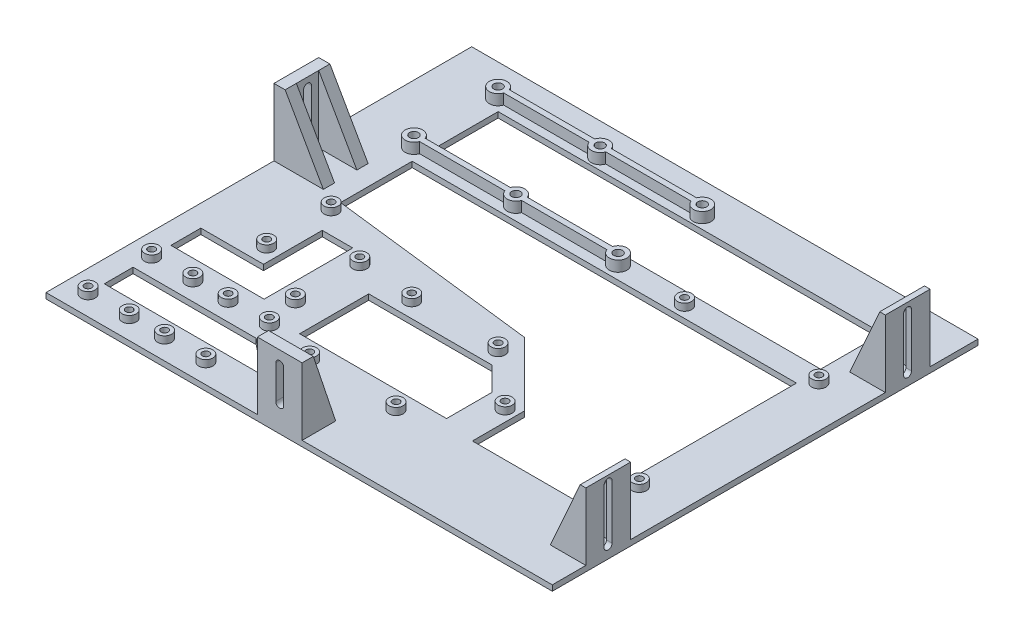
from build123d import *

# Parameters (mm, degrees)
SKETCH1_W            = 287.274
SKETCH1_H            = 241.554
BOSS_EXTRUDE1_DEPTH  = 3.175
SKETCH2_W            = 3.175
SKETCH2_H            = 25.4
BOSS_EXTRUDE3_DEPTH  = 38.1
CUT_EXTRUDE1_DEPTH   = 25.4
SKETCH4_R            = 4
SKETCH4_R_2          = 2
BOSS_EXTRUDE4_DEPTH  = 4
SKETCH5_R            = 5.000000033
SKETCH5_R_2          = 2.5
BOSS_EXTRUDE5_DEPTH  = 6
SKETCH6_R            = 4
SKETCH6_R_2          = 2
BOSS_EXTRUDE6_DEPTH  = 4
SKETCH7_R            = 4.000000001
SKETCH7_R_2          = 2
SKETCH7_R_3          = 4
BOSS_EXTRUDE7_DEPTH  = 4
SKETCH8_R            = 4
SKETCH8_R_2          = 2
BOSS_EXTRUDE8_DEPTH  = 4
SKETCH9_W            = 3.175
SKETCH9_H            = 25.4
BOSS_EXTRUDE9_DEPTH  = 38.1
CUT_EXTRUDE3_DEPTH   = 38.1
BOSS_EXTRUDE11_DEPTH = 6.35
BOSS_EXTRUDE12_DEPTH = 6.35
BOSS_EXTRUDE13_DEPTH = 6.35
SKETCH34_W           = 218.059
SKETCH34_H           = 35.052
CUT_EXTRUDE10_DEPTH  = 192.494860239
BOSS_EXTRUDE14_DEPTH = 6.35
SKETCH40_W           = 108.823999991
SKETCH40_H           = 3.175
BOSS_EXTRUDE15_DEPTH = 6
CUT_EXTRUDE13_START  = -6
SKETCH41_R           = 2.5
CUT_EXTRUDE13_DEPTH  = 6
SKETCH43_W           = 6.35
SKETCH43_H           = 25.4
BOSS_EXTRUDE16_DEPTH = 38.1
BOSS_EXTRUDE17_DEPTH = 25.4
SKETCH46_W           = 21.669999967
SKETCH46_H           = 12.7
CUT_EXTRUDE14_DEPTH  = 38.1
CUT_EXTRUDE15_DEPTH  = 38.1
SKETCH48_W           = 25.4
SKETCH48_H           = 6.35
BOSS_EXTRUDE18_DEPTH = 38.1
BOSS_EXTRUDE19_DEPTH = 25.4
SKETCH50_W           = 12.7
SKETCH50_H           = 12.7
CUT_EXTRUDE16_DEPTH  = 38.1
CUT_EXTRUDE17_DEPTH  = 38.1
CUT_EXTRUDE18_DEPTH  = 192.494860239


with BuildPart() as part:
    # Sketch1 → Boss-Extrude1 (new body)
    with BuildSketch(Plane(origin=(0, 0, 0), x_dir=(1, 0, 0), z_dir=(0, 1, 0))):
        Rectangle(SKETCH1_W, SKETCH1_H)
    extrude(amount=BOSS_EXTRUDE1_DEPTH)

    # Sketch2 → Boss-Extrude3 (add)
    with BuildSketch(Plane(origin=(0, 3.175, 0), x_dir=(1, 0, 0), z_dir=(0, 1, 0))):
        with Locations((142.0495, 80.899)):
            Rectangle(SKETCH2_W, SKETCH2_H)
    extrude(amount=BOSS_EXTRUDE3_DEPTH)

    # Sketch3 → Cut-Extrude1 (cut)
    with BuildSketch(Plane.ZY.offset(-140.462)):
        with BuildLine():
            Line((-78.558, 36.656885263), (-78.558, 6.383215744))
            ThreePointArc((-78.558, 6.383215744), (-80.808, 4.133215744), (-83.058, 6.383215744))
            Line((-83.058, 6.383215744), (-83.058, 36.656885263))
            ThreePointArc((-83.058, 36.656885263), (-80.808, 38.906885263), (-78.558, 36.656885263))
        make_face()
    extrude(amount=-CUT_EXTRUDE1_DEPTH, mode=Mode.SUBTRACT)

    # Sketch4 → Boss-Extrude4 (add)
    # profile 1 of 4: a face of its own
    with BuildSketch(Plane(origin=(0, 3.175, 0), x_dir=(1, 0, 0), z_dir=(0, 1, 0))):
        with Locations(Location((43.942, 53.975, 0), (0, 0, 270))):
            Circle(SKETCH4_R)
        with Locations(Location((43.942, 53.975, 0), (0, 0, 90))):
            Circle(SKETCH4_R_2, mode=Mode.SUBTRACT)
    # profile 2 of 4: a face of its own
    with BuildSketch(Plane(origin=(0, 3.175, 0), x_dir=(1, 0, 0), z_dir=(0, 1, 0))):
        with Locations(Location((120.142, 53.975, 0), (0, 0, 90))):
            Circle(SKETCH4_R)
        with Locations(Location((120.142, 53.975, 0), (0, 0, 270))):
            Circle(SKETCH4_R_2, mode=Mode.SUBTRACT)
    # profile 3 of 4: a face of its own
    with BuildSketch(Plane(origin=(0, 3.175, 0), x_dir=(1, 0, 0), z_dir=(0, 1, 0))):
        with Locations(Location((43.942, -47.879, 0), (0, 0, 90))):
            Circle(SKETCH4_R)
        with Locations(Location((43.942, -47.879, 0), (0, 0, 270))):
            Circle(SKETCH4_R_2, mode=Mode.SUBTRACT)
    # profile 4 of 4: a face of its own
    with BuildSketch(Plane(origin=(0, 3.175, 0), x_dir=(1, 0, 0), z_dir=(0, 1, 0))):
        with Locations(Location((120.142, -47.879, 0), (0, 0, 270))):
            Circle(SKETCH4_R)
        with Locations(Location((120.142, -47.879, 0), (0, 0, 90))):
            Circle(SKETCH4_R_2, mode=Mode.SUBTRACT)
    extrude(amount=BOSS_EXTRUDE4_DEPTH)

    # Sketch5 → Boss-Extrude5 (add)
    # profile 1 of 9: a face of its own
    with BuildSketch(Plane(origin=(0, 3.175, 0), x_dir=(1, 0, 0), z_dir=(0, 1, 0))):
        with Locations(Location((-110.617, 102.743, 0), (0, 0, 90))):
            Circle(SKETCH5_R)
        with Locations(Location((-110.617, 102.743, 0), (0, 0, 270))):
            Circle(SKETCH5_R_2, mode=Mode.SUBTRACT)
    # profile 2 of 9: a face of its own
    with BuildSketch(Plane(origin=(0, 3.175, 0), x_dir=(1, 0, 0), z_dir=(0, 1, 0))):
        with Locations(Location((-52.705, 102.743, 0), (0, 0, 90))):
            Circle(SKETCH5_R)
        with Locations(Location((-52.705, 102.743, 0), (0, 0, 270))):
            Circle(SKETCH5_R_2, mode=Mode.SUBTRACT)
    # profile 3 of 9: a face of its own
    with BuildSketch(Plane(origin=(0, 3.175, 0), x_dir=(1, 0, 0), z_dir=(0, 1, 0))):
        with BuildLine():
            ThreePointArc((10.207000033, 102.743), (10.192688966, 103.121028926), (10.149837686, 103.496893852))
            Line((10.149837686, 103.496893852), (7.590619949, 103.496893852))
            ThreePointArc((7.590619949, 103.496893852), (7.677733684, 103.124411935), (7.707, 102.743))
            ThreePointArc((7.707, 102.743), (3.439233047, 100.975233047), (5.207, 105.243))
            Line((5.207, 105.243), (5.207, 107.743000033))
            ThreePointArc((5.207, 107.743000033), (1.671466071, 99.207466071), (10.207000033, 102.743))
        make_face()
    # profile 4 of 9: a face of its own
    with BuildSketch(Plane(origin=(0, 3.175, 0), x_dir=(1, 0, 0), z_dir=(0, 1, 0))):
        with BuildLine():
            Line((7.590619949, 103.496893852), (10.149837686, 103.496893852))
            ThreePointArc((10.149837686, 103.496893852), (8.46510766, 106.535721293), (5.207, 107.743000033))
            Line((5.207, 107.743000033), (5.207, 105.243))
            ThreePointArc((5.207, 105.243), (6.684373577, 104.759771508), (7.590619949, 103.496893852))
        make_face()
    # profile 5 of 9: a face of its own
    with BuildSketch(Plane(origin=(0, 3.175, 0), x_dir=(1, 0, 0), z_dir=(0, 1, 0))):
        with BuildLine():
            ThreePointArc((10.207000033, 102.743), (10.192688966, 103.121028926), (10.149837686, 103.496893852))
            Line((10.149837686, 103.496893852), (7.590619949, 103.496893852))
            ThreePointArc((7.590619949, 103.496893852), (7.677733684, 103.124411935), (7.707, 102.743))
            ThreePointArc((7.707, 102.743), (3.439233047, 100.975233047), (5.207, 105.243))
            Line((5.207, 105.243), (5.207, 107.743000033))
            ThreePointArc((5.207, 107.743000033), (1.671466071, 99.207466071), (10.207000033, 102.743))
        make_face()
    # profile 6 of 9: a face of its own
    with BuildSketch(Plane(origin=(0, 3.175, 0), x_dir=(1, 0, 0), z_dir=(0, 1, 0))):
        with BuildLine():
            Line((7.590619949, 103.496893852), (10.149837686, 103.496893852))
            ThreePointArc((10.149837686, 103.496893852), (8.46510766, 106.535721293), (5.207, 107.743000033))
            Line((5.207, 107.743000033), (5.207, 105.243))
            ThreePointArc((5.207, 105.243), (6.684373577, 104.759771508), (7.590619949, 103.496893852))
        make_face()
    # profile 7 of 9: a face of its own
    with BuildSketch(Plane(origin=(0, 3.175, 0), x_dir=(1, 0, 0), z_dir=(0, 1, 0))):
        with Locations(Location((-110.617, 54.991, 0), (0, 0, 90))):
            Circle(SKETCH5_R)
        with Locations(Location((-110.617, 54.991, 0), (0, 0, 270))):
            Circle(SKETCH5_R_2, mode=Mode.SUBTRACT)
    # profile 8 of 9: a face of its own
    with BuildSketch(Plane(origin=(0, 3.175, 0), x_dir=(1, 0, 0), z_dir=(0, 1, 0))):
        with Locations(Location((-52.705, 54.991, 0), (0, 0, 90))):
            Circle(SKETCH5_R)
        with Locations(Location((-52.705, 54.991, 0), (0, 0, 270))):
            Circle(SKETCH5_R_2, mode=Mode.SUBTRACT)
    # profile 9 of 9: a face of its own
    with BuildSketch(Plane(origin=(0, 3.175, 0), x_dir=(1, 0, 0), z_dir=(0, 1, 0))):
        with Locations(Location((5.207, 54.991, 0), (0, 0, 90))):
            Circle(SKETCH5_R)
        with Locations(Location((5.207, 54.991, 0), (0, 0, 270))):
            Circle(SKETCH5_R_2, mode=Mode.SUBTRACT)
    extrude(amount=BOSS_EXTRUDE5_DEPTH)

    # Sketch6 → Boss-Extrude6 (add)
    # profile 1 of 8: a face of its own
    with BuildSketch(Plane(origin=(0, 3.175, 0), x_dir=(1, 0, 0), z_dir=(0, 1, 0))):
        with Locations(Location((-130.937, -73.533, 0), (0, 0, 90))):
            Circle(SKETCH6_R)
        with Locations(Location((-130.937, -73.533, 0), (0, 0, 270))):
            Circle(SKETCH6_R_2, mode=Mode.SUBTRACT)
    # profile 2 of 8: a face of its own
    with BuildSketch(Plane(origin=(0, 3.175, 0), x_dir=(1, 0, 0), z_dir=(0, 1, 0))):
        with Locations(Location((-107.569, -73.533, 0), (0, 0, 90))):
            Circle(SKETCH6_R)
        with Locations(Location((-107.569, -73.533, 0), (0, 0, 270))):
            Circle(SKETCH6_R_2, mode=Mode.SUBTRACT)
    # profile 3 of 8: a face of its own
    with BuildSketch(Plane(origin=(0, 3.175, 0), x_dir=(1, 0, 0), z_dir=(0, 1, 0))):
        with Locations(Location((-130.937, -109.601, 0), (0, 0, 90))):
            Circle(SKETCH6_R)
        with Locations(Location((-130.937, -109.601, 0), (0, 0, 270))):
            Circle(SKETCH6_R_2, mode=Mode.SUBTRACT)
    # profile 4 of 8: a face of its own
    with BuildSketch(Plane(origin=(0, 3.175, 0), x_dir=(1, 0, 0), z_dir=(0, 1, 0))):
        with Locations(Location((-107.569, -109.601, 0), (0, 0, 90))):
            Circle(SKETCH6_R)
        with Locations(Location((-107.569, -109.601, 0), (0, 0, 270))):
            Circle(SKETCH6_R_2, mode=Mode.SUBTRACT)
    # profile 5 of 8: a face of its own
    with BuildSketch(Plane(origin=(0, 3.175, 0), x_dir=(1, 0, 0), z_dir=(0, 1, 0))):
        with Locations(Location((-87.503, -73.533, 0), (0, 0, 90))):
            Circle(SKETCH6_R)
        with Locations(Location((-87.503, -73.533, 0), (0, 0, 270))):
            Circle(SKETCH6_R_2, mode=Mode.SUBTRACT)
    # profile 6 of 8: a face of its own
    with BuildSketch(Plane(origin=(0, 3.175, 0), x_dir=(1, 0, 0), z_dir=(0, 1, 0))):
        with Locations(Location((-64.135, -73.533, 0), (0, 0, 90))):
            Circle(SKETCH6_R)
        with Locations(Location((-64.135, -73.533, 0), (0, 0, 270))):
            Circle(SKETCH6_R_2, mode=Mode.SUBTRACT)
    # profile 7 of 8: a face of its own
    with BuildSketch(Plane(origin=(0, 3.175, 0), x_dir=(1, 0, 0), z_dir=(0, 1, 0))):
        with Locations(Location((-87.503, -109.601, 0), (0, 0, 90))):
            Circle(SKETCH6_R)
        with Locations(Location((-87.503, -109.601, 0), (0, 0, 270))):
            Circle(SKETCH6_R_2, mode=Mode.SUBTRACT)
    # profile 8 of 8: a face of its own
    with BuildSketch(Plane(origin=(0, 3.175, 0), x_dir=(1, 0, 0), z_dir=(0, 1, 0))):
        with Locations(Location((-64.135, -109.601, 0), (0, 0, 90))):
            Circle(SKETCH6_R)
        with Locations(Location((-64.135, -109.601, 0), (0, 0, 270))):
            Circle(SKETCH6_R_2, mode=Mode.SUBTRACT)
    extrude(amount=BOSS_EXTRUDE6_DEPTH)

    # Sketch7 → Boss-Extrude7 (add)
    # profile 1 of 4: a face of its own
    with BuildSketch(Plane(origin=(0, 3.175, 0), x_dir=(1, 0, 0), z_dir=(0, 1, 0))):
        with Locations(Location((-103.251, -35.941, 0), (0, 0, 90))):
            Circle(SKETCH7_R)
        with Locations(Location((-103.251, -35.941, 0), (0, 0, 270))):
            Circle(SKETCH7_R_2, mode=Mode.SUBTRACT)
    # profile 2 of 4: a face of its own
    with BuildSketch(Plane(origin=(0, 3.175, 0), x_dir=(1, 0, 0), z_dir=(0, 1, 0))):
        with Locations(Location((-68.199, -54.737, 0), (0, 0, 90))):
            Circle(SKETCH7_R_3)
        with Locations(Location((-68.199, -54.737, 0), (0, 0, 270))):
            Circle(SKETCH7_R_2, mode=Mode.SUBTRACT)
    # profile 3 of 4: a face of its own
    with BuildSketch(Plane(origin=(0, 3.175, 0), x_dir=(1, 0, 0), z_dir=(0, 1, 0))):
        with Locations(Location((-103.251, 0.635, 0), (0, 0, 90))):
            Circle(SKETCH7_R_3)
        with Locations(Location((-103.251, 0.635, 0), (0, 0, 270))):
            Circle(SKETCH7_R_2, mode=Mode.SUBTRACT)
    # profile 4 of 4: a face of its own
    with BuildSketch(Plane(origin=(0, 3.175, 0), x_dir=(1, 0, 0), z_dir=(0, 1, 0))):
        with Locations(Location((-68.199, -18.161, 0), (0, 0, 90))):
            Circle(SKETCH7_R_3)
        with Locations(Location((-68.199, -18.161, 0), (0, 0, 270))):
            Circle(SKETCH7_R_2, mode=Mode.SUBTRACT)
    extrude(amount=BOSS_EXTRUDE7_DEPTH)

    # Sketch8 → Boss-Extrude8 (add)
    # profile 1 of 4: a face of its own
    with BuildSketch(Plane(origin=(0, 3.175, 0), x_dir=(1, 0, 0), z_dir=(0, 1, 0))):
        with Locations(Location((-35.687, -21.209, 0), (0, 0, 90))):
            Circle(SKETCH8_R)
        with Locations(Location((-35.687, -21.209, 0), (0, 0, 270))):
            Circle(SKETCH8_R_2, mode=Mode.SUBTRACT)
    # profile 2 of 4: a face of its own
    with BuildSketch(Plane(origin=(0, 3.175, 0), x_dir=(1, 0, 0), z_dir=(0, 1, 0))):
        with Locations(Location((13.335, -21.209, 0), (0, 0, 90))):
            Circle(SKETCH8_R)
        with Locations(Location((13.335, -21.209, 0), (0, 0, 270))):
            Circle(SKETCH8_R_2, mode=Mode.SUBTRACT)
    # profile 3 of 4: a face of its own
    with BuildSketch(Plane(origin=(0, 3.175, 0), x_dir=(1, 0, 0), z_dir=(0, 1, 0))):
        with Locations(Location((-35.687, -79.121, 0), (0, 0, 90))):
            Circle(SKETCH8_R)
        with Locations(Location((-35.687, -79.121, 0), (0, 0, 270))):
            Circle(SKETCH8_R_2, mode=Mode.SUBTRACT)
    # profile 4 of 4: a face of its own
    with BuildSketch(Plane(origin=(0, 3.175, 0), x_dir=(1, 0, 0), z_dir=(0, 1, 0))):
        with Locations(Location((13.335, -79.121, 0), (0, 0, 90))):
            Circle(SKETCH8_R)
        with Locations(Location((13.335, -79.121, 0), (0, 0, 270))):
            Circle(SKETCH8_R_2, mode=Mode.SUBTRACT)
    extrude(amount=BOSS_EXTRUDE8_DEPTH)

    # Sketch9 → Boss-Extrude9 (add)
    with BuildSketch(Plane(origin=(0, 3.175, 0), x_dir=(1, 0, 0), z_dir=(0, 1, 0))):
        with Locations((142.0495, -89.027)):
            Rectangle(SKETCH9_W, SKETCH9_H)
    extrude(amount=BOSS_EXTRUDE9_DEPTH)

    # Sketch13 → Cut-Extrude3 (cut)
    with BuildSketch(Plane.ZY.offset(-140.462)):
        with BuildLine():
            Line((91.368, 37.446352615), (91.368, 6.709880429))
            ThreePointArc((91.368, 6.709880429), (89.118, 4.459880429), (86.868, 6.709880429))
            Line((86.868, 6.709880429), (86.868, 37.446352615))
            ThreePointArc((86.868, 37.446352615), (89.118, 39.696352615), (91.368, 37.446352615))
        make_face()
    extrude(amount=-CUT_EXTRUDE3_DEPTH, mode=Mode.SUBTRACT)

    # Sketch17 → Boss-Extrude11 (add)
    with BuildSketch(Plane(origin=(0, 0, -93.599), x_dir=(-1, 0, 0), z_dir=(0, 0, -1))):
        Polygon((-140.462, 41.275), (-124.142, 3.175), (-127.215984775, 3.175), (-140.462, 3.175), (-140.462, 32.830257966), align=None)
    extrude(amount=-BOSS_EXTRUDE11_DEPTH)

    # Sketch22 → Boss-Extrude12 (add)
    with BuildSketch(Plane(origin=(0, 0, 76.327), x_dir=(-1, 0, 0), z_dir=(0, 0, -1))):
        Polygon((-140.462, 41.275), (-123.444, 3.175), (-127.215984775, 3.175), (-140.462, 3.175), (-140.462, 32.830257966), align=None)
    extrude(amount=-BOSS_EXTRUDE12_DEPTH)

    # Sketch23 → Boss-Extrude13 (add)
    with BuildSketch(Plane.XY.offset(-68.199)):
        Polygon((140.462, 41.275), (123.444, 3.175), (127.215984775, 3.175), (140.462, 3.175), (140.462, 32.830257966), align=None)
    extrude(amount=-BOSS_EXTRUDE13_DEPTH)

    # Sketch34 → Cut-Extrude10 (cut, through all)
    with BuildSketch(Plane(origin=(0, 3.175, 0), x_dir=(1, 0, 0), z_dir=(0, 1, 0))):
        with Locations((4.7625, 78.867)):
            Rectangle(SKETCH34_W, SKETCH34_H)
        Polygon((-104.267, 47.625), (113.792, 47.625), (113.792, 6.985), (113.792, -54.229), (113.792, -72.771), (50.292, -72.771), (50.292, -54.229), (50.292, -43.230804088), (14.123058449, -7.061862538), (-104.267, 6.985), align=None)
        Polygon((-51.424928133, -29.885116369), (-51.424928133, -69.08745541), (31.941817721, -69.08745541), (31.941817721, -43.230804088), (18.596130001, -29.885116369), align=None)
    extrude(amount=-CUT_EXTRUDE10_DEPTH, mode=Mode.SUBTRACT)

    # Sketch37 → Boss-Extrude14 (add)
    with BuildSketch(Plane.XY.offset(101.727)):
        Polygon((140.462, 41.275), (123.444, 3.175), (140.462, 3.175), align=None)
    extrude(amount=-BOSS_EXTRUDE14_DEPTH)

    # Sketch40 → Boss-Extrude15 (add)
    with BuildSketch(Plane(origin=(0, 3.175, 0), x_dir=(1, 0, 0), z_dir=(0, 1, 0))):
        with Locations((-52.704999996, 102.743)):
            Rectangle(SKETCH40_W, SKETCH40_H)
        with Locations((-52.704999996, 54.991)):
            Rectangle(SKETCH40_W, SKETCH40_H)
    extrude(amount=BOSS_EXTRUDE15_DEPTH)

    # Sketch41 → Cut-Extrude13 (cut)
    with BuildSketch(Plane(origin=(0, 9.175, 0), x_dir=(1, 0, 0), z_dir=(0, 1, 0)).offset(CUT_EXTRUDE13_START)):
        with Locations(Location((-52.705, 54.991, 0), (0, 0, 270))):
            Circle(SKETCH41_R)
        with Locations(Location((-52.705, 102.743, 0), (0, 0, 270))):
            Circle(SKETCH41_R)
    extrude(amount=CUT_EXTRUDE13_DEPTH, mode=Mode.SUBTRACT)

    # Sketch43 → Boss-Extrude16 (add)
    with BuildSketch(Plane(origin=(0, 3.175, 0), x_dir=(1, 0, 0), z_dir=(0, 1, 0))):
        with Locations((-140.462, 21.273527035)):
            Rectangle(SKETCH43_W, SKETCH43_H)
    extrude(amount=BOSS_EXTRUDE16_DEPTH)

    # Sketch45 → Boss-Extrude17 (add)
    with BuildSketch(Plane.XY.offset(-8.573527035)):
        Polygon((-137.287, 41.275), (-115.617000033, 3.175), (-137.287, 3.175), align=None)
    extrude(amount=-BOSS_EXTRUDE17_DEPTH)

    # Sketch46 → Cut-Extrude14 (cut)
    with BuildSketch(Plane(origin=(0, 41.275, 0), x_dir=(1, 0, 0), z_dir=(0, 1, 0))):
        with Locations((-126.452000017, 21.273527035)):
            Rectangle(SKETCH46_W, SKETCH46_H)
    extrude(amount=-CUT_EXTRUDE14_DEPTH, mode=Mode.SUBTRACT)

    # Sketch47 → Cut-Extrude15 (cut)
    with BuildSketch(Plane.ZY.offset(143.637)):
        with BuildLine():
            Line((-19.023527035, 35.920841866), (-19.023527035, 10.520841866))
            ThreePointArc((-19.023527035, 10.520841866), (-21.273527035, 8.270841866), (-23.523527035, 10.520841866))
            Line((-23.523527035, 10.520841866), (-23.523527035, 35.920841866))
            ThreePointArc((-23.523527035, 35.920841866), (-21.273527035, 38.170841866), (-19.023527035, 35.920841866))
        make_face()
    extrude(amount=-CUT_EXTRUDE15_DEPTH, mode=Mode.SUBTRACT)

    # Sketch48 → Boss-Extrude18 (add)
    with BuildSketch(Plane(origin=(0, 3.175, 0), x_dir=(1, 0, 0), z_dir=(0, 1, 0))):
        with Locations((-11.0167445, -117.602)):
            Rectangle(SKETCH48_W, SKETCH48_H)
    extrude(amount=BOSS_EXTRUDE18_DEPTH)

    # Sketch49 → Boss-Extrude19 (add)
    with BuildSketch(Plane(origin=(1.6832555, 0, 0), x_dir=(0, 0, -1), z_dir=(1, 0, 0))):
        Polygon((-114.427, 41.275), (-101.727, 3.175), (-114.427, 3.175), align=None)
    extrude(amount=-BOSS_EXTRUDE19_DEPTH)

    # Sketch50 → Cut-Extrude16 (cut)
    with BuildSketch(Plane(origin=(0, 41.275, 0), x_dir=(1, 0, 0), z_dir=(0, 1, 0))):
        with Locations((-11.0167445, -108.077)):
            Rectangle(SKETCH50_W, SKETCH50_H)
    extrude(amount=-CUT_EXTRUDE16_DEPTH, mode=Mode.SUBTRACT)

    # Sketch51 → Cut-Extrude17 (cut)
    with BuildSketch(Plane.XY.offset(120.777)):
        with BuildLine():
            Line((-8.7667445, 33.783571479), (-8.7667445, 14.877069328))
            ThreePointArc((-8.7667445, 14.877069328), (-11.0167445, 12.627069328), (-13.2667445, 14.877069328))
            Line((-13.2667445, 14.877069328), (-13.2667445, 33.783571479))
            ThreePointArc((-13.2667445, 33.783571479), (-11.0167445, 36.033571479), (-8.7667445, 33.783571479))
        make_face()
    extrude(amount=-CUT_EXTRUDE17_DEPTH, mode=Mode.SUBTRACT)

    # Sketch52 → Cut-Extrude18 (cut, through all)
    with BuildSketch(Plane(origin=(0, 3.175, 0), x_dir=(1, 0, 0), z_dir=(0, 1, 0))):
        Polygon((-95.806722173, -11.855681339), (-78.503835894, -11.855681339), (-78.503835894, -62.162221075), (-131.37376619, -62.162221075), (-131.37376619, -45.179758617), (-95.806722173, -45.179758617), align=None)
        Polygon((-131.37376619, -83.630617014), (-131.37376619, -99.972231833), (-41.014248957, -99.972231833), (-61.521373435, -83.630617014), align=None)
    extrude(amount=-CUT_EXTRUDE18_DEPTH, mode=Mode.SUBTRACT)


solid = part.part
